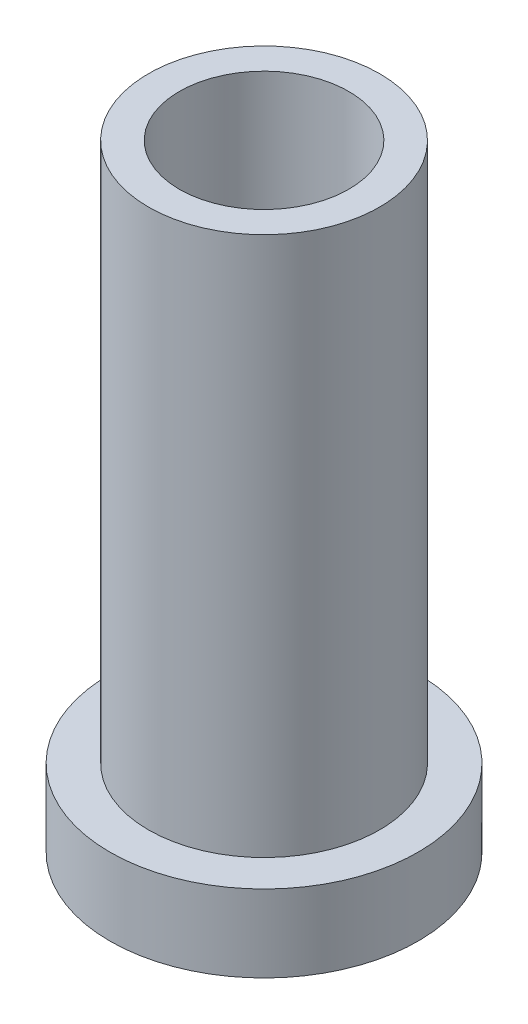
from build123d import *

# Parameters (mm, degrees)
SKETCH1_R           = 10
SKETCH1_R_2         = 7.5
BOSS_EXTRUDE1_DEPTH = 5
SKETCH1_3_R         = 7.5
SKETCH1_3_R_2       = 5.5
BOSS_EXTRUDE2_DEPTH = 40


with BuildPart() as part:
    # Sketch1 → Boss-Extrude1 (new body)
    with BuildSketch(Plane(origin=(0, 0, 0), x_dir=(1, 0, 0), z_dir=(0, 1, 0))):
        Circle(SKETCH1_R)
        Circle(SKETCH1_R_2, mode=Mode.SUBTRACT)
    extrude(amount=BOSS_EXTRUDE1_DEPTH)

    # Sketch1<3> → Boss-Extrude2 (add)
    with BuildSketch(Plane(origin=(0, 0, 0), x_dir=(1, 0, 0), z_dir=(0, 1, 0))):
        Circle(SKETCH1_3_R)
        Circle(SKETCH1_3_R_2, mode=Mode.SUBTRACT)
    extrude(amount=BOSS_EXTRUDE2_DEPTH)


solid = part.part
